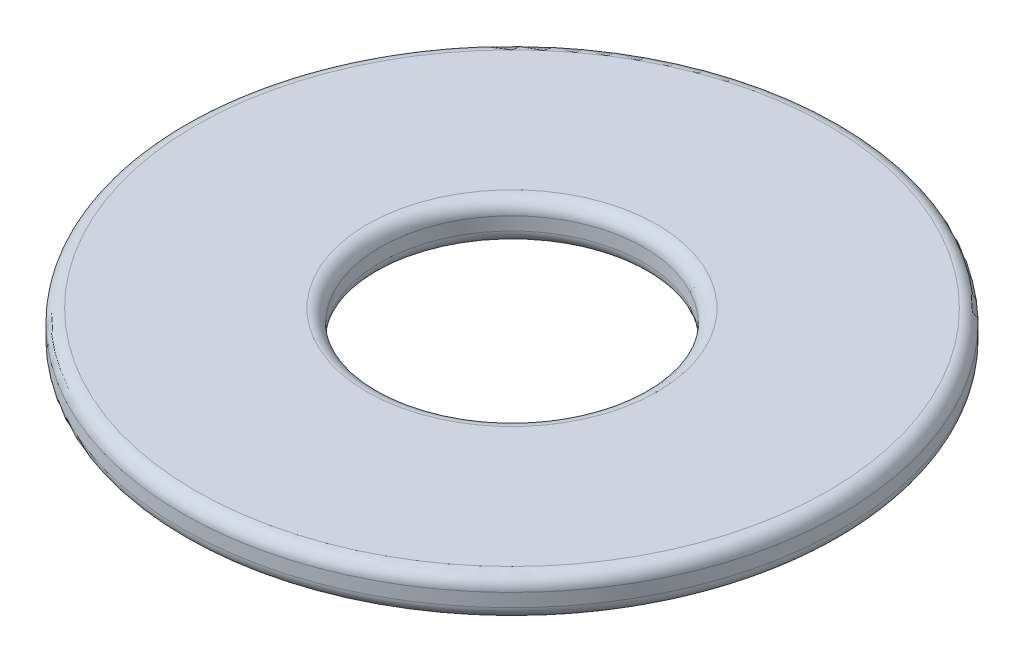
from build123d import *

# Parameters (mm, degrees)
SKETCH1_R           = 10
SKETCH1_R_2         = 4
BOSS_EXTRUDE1_DEPTH = 1.2
FILLET1_R           = 0.4


with BuildPart() as part:
    # Sketch1 → Boss-Extrude1 (new body)
    with BuildSketch(Plane(origin=(0, 0, 0), x_dir=(1, 0, 0), z_dir=(0, 1, 0))):
        with Locations(Location((0, 0, 0), (0, 0, 270))):
            Circle(SKETCH1_R)
        with Locations(Location((0, 0, 0), (0, 0, 270))):
            Circle(SKETCH1_R_2, mode=Mode.SUBTRACT)
    extrude(amount=BOSS_EXTRUDE1_DEPTH)

    # Fillet1
    fillet1_edges = [part.edges().sort_by_distance(p)[0] for p in [
        (0, 0, -10),
        (0, 1.2, -10),
        (0, 0, -4),
        (0, 1.2, -4),
    ]]
    fillet(fillet1_edges, radius=FILLET1_R)


solid = part.part
